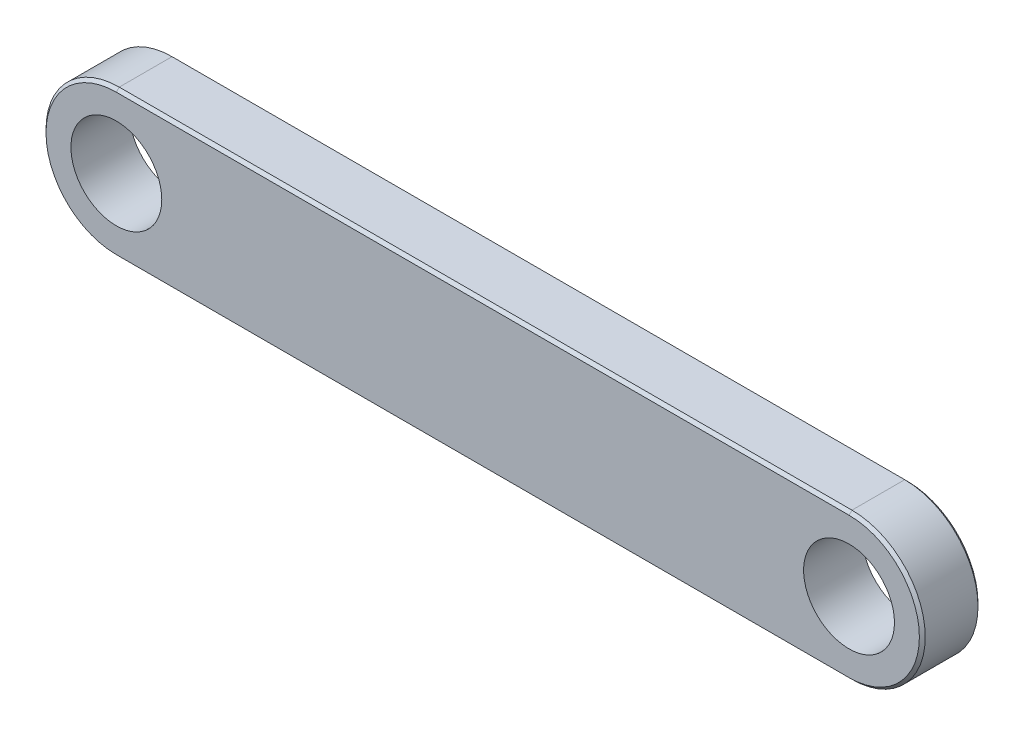
from build123d import *

# Parameters (mm, degrees)
SKETCH2_R           = 1.55
BOSS_EXTRUDE1_DEPTH = 2
CHAMFER1_SIZE       = 0.1


with BuildPart() as part:
    # Sketch2 → Boss-Extrude1 (new body)
    with BuildSketch(Plane.XY):
        with BuildLine():
            Line((-11.338048091, 2.5), (13.661951909, 2.5))
            ThreePointArc((13.661951909, 2.5), (16.161951909, 0), (13.661951909, -2.5))
            Line((13.661951909, -2.5), (-11.338048091, -2.5))
            ThreePointArc((-11.338048091, -2.5), (-13.838048091, 0), (-11.338048091, 2.5))
        make_face()
        with Locations((13.661951909, 0)):
            Circle(SKETCH2_R, mode=Mode.SUBTRACT)
        with Locations((-11.338048091, 0)):
            Circle(SKETCH2_R, mode=Mode.SUBTRACT)
    extrude(amount=BOSS_EXTRUDE1_DEPTH)

    # Chamfer1
    chamfer1_edges = [part.edges().sort_by_distance(p)[0] for p in [
        (16.161951909, 0, 2),
        (1.161951909, 2.5, 2),
        (-13.838048091, 0, 2),
        (1.161951909, 2.5, 0),
        (16.161951909, 0, 0),
        (1.161951909, -2.5, 0),
        (-13.838048091, 0, 0),
        (1.161951909, -2.5, 2),
    ]]
    chamfer(chamfer1_edges, length=CHAMFER1_SIZE)


solid = part.part
